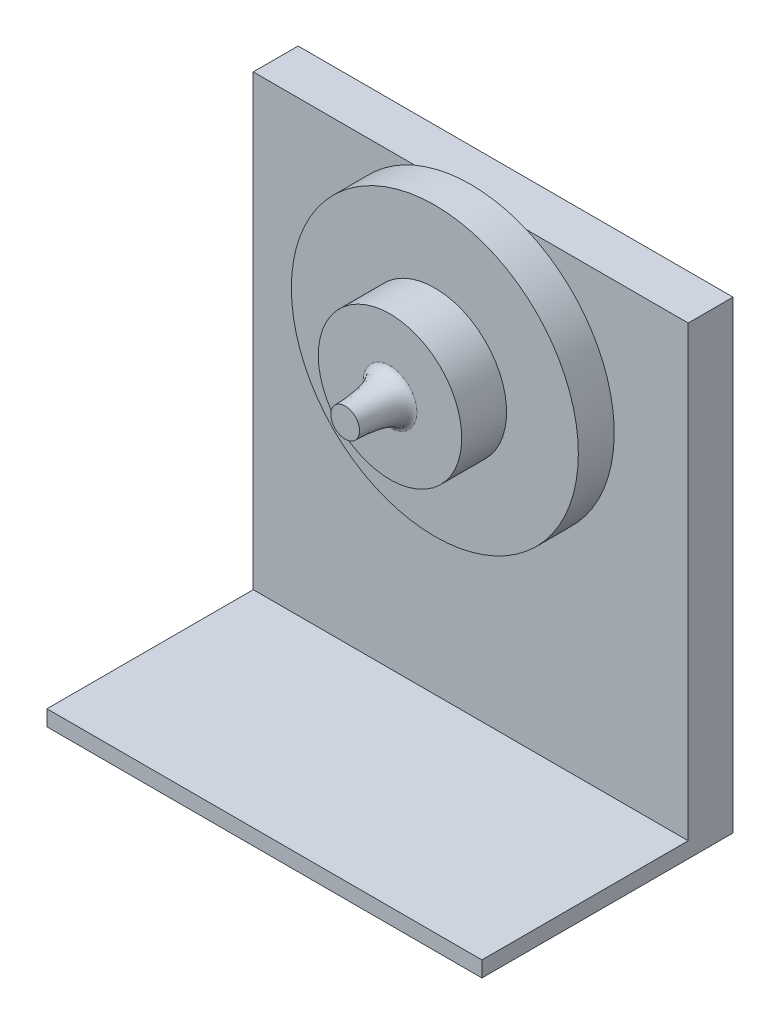
from build123d import *

# Parameters (mm, degrees)
SKETCH1_W           = 485
SKETCH1_H           = 500
BOSS_EXTRUDE1_DEPTH = 50
SKETCH2_W           = 485
SKETCH2_H           = 280
BOSS_EXTRUDE2_DEPTH = 17.5


with BuildPart() as part:
    # Sketch1 → Boss-Extrude1 (new body)
    with BuildSketch(Plane.XY):
        with Locations((0, 250)):
            Rectangle(SKETCH1_W, SKETCH1_H)
    extrude(amount=-BOSS_EXTRUDE1_DEPTH)

    # Sketch2 → Boss-Extrude2 (add)
    with BuildSketch(Plane(origin=(0, 0, 0), x_dir=(1, 0, 0), z_dir=(0, 1, 0))):
        with Locations((0, -90)):
            Rectangle(SKETCH2_W, SKETCH2_H)
    extrude(amount=-BOSS_EXTRUDE2_DEPTH)

    # Sketch6 → Revolve1 (revolve)
    with BuildSketch(Plane(origin=(0, 352.6, 0), x_dir=(1, 0, 0), z_dir=(0, 1, 0)), mode=Mode.PRIVATE) as revolve1_sk:
        with BuildLine():
            Line((0, 0), (160, 0))
            Line((160, 0), (160, -40))
            Line((160, -40), (80, -40))
            Line((80, -40), (80, -90))
            Line((80, -90), (30, -90))
            add(Edge.make_bspline(
                [(30, -90), (19.305392217, -92.013307308), (16, -123.873269223), (16, -140)],
                knots=[0, 0, 0, 0, 1, 1, 1, 1], degree=3))
            Line((16, -140), (15.691041026, -140))
            Line((15.691041026, -140), (0, -140))
            Line((0, -140), (0, 0))
        make_face()
    revolve(revolve1_sk.sketch.rotate(Axis((0, 352.6, 0), (0, 0, 1)), 180), axis=Axis((0, 352.6, 0), (0, 0, 1)))


solid = part.part
